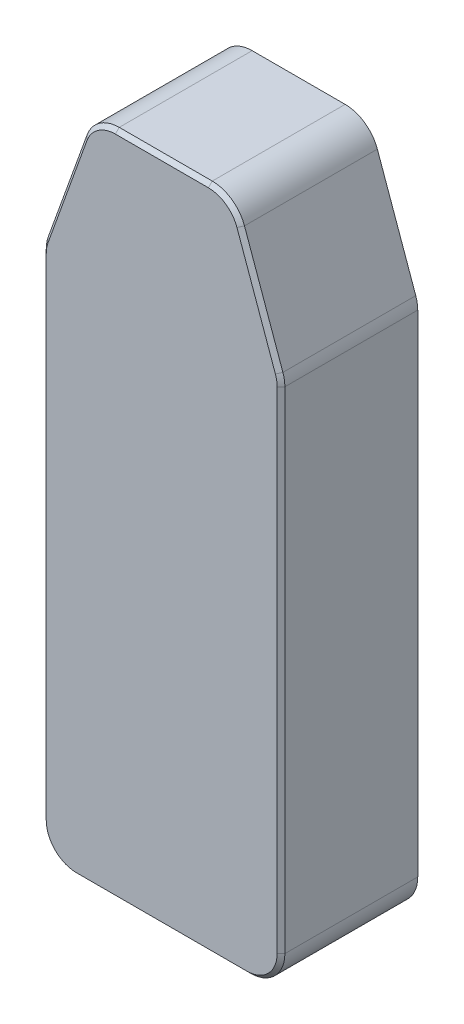
from build123d import *

# Parameters (mm, degrees)
BOSS_EXTRUDE1_DEPTH = 50
BOSS_EXTRUDE2_DEPTH = 3
CHAMFER1_SIZE       = 1.5


with BuildPart() as part:
    # Sketch1 → Boss-Extrude1 (new body)
    with BuildSketch(Plane.XY):
        with BuildLine():
            Line((-46.25, 77.25220626), (-46.25, -113))
            ThreePointArc((-46.25, -113), (-42.369164851, -122.369164851), (-33, -126.25))
            Line((-33, -126.25), (33, -126.25))
            ThreePointArc((33, -126.25), (42.369164851, -122.369164851), (46.25, -113))
            Line((46.25, -113), (46.25, 77.269287137))
            ThreePointArc((46.25, 77.269287137), (46.055906569, 79.528889681), (45.479312656, 81.722292374))
            Line((45.479312656, 81.722292374), (30.588501914, 123.453005237))
            ThreePointArc((30.588501914, 123.453005237), (25.743329046, 129.829700351), (18.109189258, 132.25))
            Line((18.109189258, 132.25), (-17.946852503, 132.25))
            ThreePointArc((-17.946852503, 132.25), (-25.56302687, 129.842342367), (-30.411330997, 123.494360454))
            Line((-30.411330997, 123.494360454), (-45.464478493, 81.746566714))
            ThreePointArc((-45.464478493, 81.746566714), (-46.052142354, 79.53345153), (-46.25, 77.25220626))
        make_face()
        with BuildLine():
            ThreePointArc((-43.25, -113), (-40.247844507, -120.247844507), (-33, -123.25))
            Line((-33, -123.25), (33, -123.25))
            ThreePointArc((33, -123.25), (40.247844507, -120.247844507), (43.25, -113))
            Line((43.25, -113), (43.25, 77.269287137))
            ThreePointArc((43.25, 77.269287137), (43.099852252, 79.017281558), (42.653807903, 80.714064773))
            Line((42.653807903, 80.714064773), (27.762997162, 122.444777636))
            ThreePointArc((27.762997162, 122.444777636), (24.014844566, 127.377692725), (18.109189258, 129.25))
            Line((18.109189258, 129.25), (-17.946852503, 129.25))
            ThreePointArc((-17.946852503, 129.25), (-23.838610033, 127.387472397), (-27.589184923, 122.476769408))
            Line((-27.589184923, 122.476769408), (-42.642332419, 80.728975668))
            ThreePointArc((-42.642332419, 80.728975668), (-43.096940311, 79.016943167), (-43.25, 77.25220626))
            Line((-43.25, 77.25220626), (-43.25, -113))
        make_face(mode=Mode.SUBTRACT)
    extrude(amount=BOSS_EXTRUDE1_DEPTH)

    # Sketch3 → Boss-Extrude2 (add)
    with BuildSketch(Plane.XY.offset(50)):
        with BuildLine():
            Line((-46.25, 77.25220626), (-46.25, -113))
            ThreePointArc((-46.25, -113), (-42.369164851, -122.369164851), (-33, -126.25))
            Line((-33, -126.25), (33, -126.25))
            ThreePointArc((33, -126.25), (42.369164851, -122.369164851), (46.25, -113))
            Line((46.25, -113), (46.25, 77.269287137))
            ThreePointArc((46.25, 77.269287137), (46.055906569, 79.528889681), (45.479312656, 81.722292374))
            Line((45.479312656, 81.722292374), (30.588501914, 123.453005237))
            ThreePointArc((30.588501914, 123.453005237), (25.743329046, 129.829700351), (18.109189258, 132.25))
            Line((18.109189258, 132.25), (-17.946852503, 132.25))
            ThreePointArc((-17.946852503, 132.25), (-25.56302687, 129.842342367), (-30.411330997, 123.494360454))
            Line((-30.411330997, 123.494360454), (-45.464478493, 81.746566714))
            ThreePointArc((-45.464478493, 81.746566714), (-46.052142354, 79.53345153), (-46.25, 77.25220626))
        make_face()
    extrude(amount=BOSS_EXTRUDE2_DEPTH)

    # Chamfer1
    chamfer1_edges = [part.edges().sort_by_distance(p)[0] for p in [
        (0, -123.25, 0),
        (40.247844507, -120.247844507, 0),
        (43.25, -17.865356432, 0),
        (43.099852252, 79.017281558, 0),
        (35.208402533, 101.579421205, 0),
        (24.014844566, 127.377692725, 0),
        (0.081168378, 129.25, 0),
        (-23.838610033, 127.387472397, 0),
        (-35.115758671, 101.602872538, 0),
        (-43.096940311, 79.016943167, 0),
        (-43.25, -17.87389687, 0),
        (-40.247844507, -120.247844507, 0),
        (-46.052142354, 79.53345153, 53),
        (-46.25, -17.87389687, 53),
        (-42.369164851, -122.369164851, 53),
        (0, -126.25, 53),
        (42.369164851, -122.369164851, 53),
        (46.25, -17.865356432, 53),
        (46.055906569, 79.528889681, 53),
        (38.033907285, 102.587648806, 53),
        (25.743329046, 129.829700351, 53),
        (0.081168378, 132.25, 53),
        (-25.56302687, 129.842342367, 53),
        (-37.937904745, 102.620463584, 53),
    ]]
    chamfer(chamfer1_edges, length=CHAMFER1_SIZE)


solid = part.part
